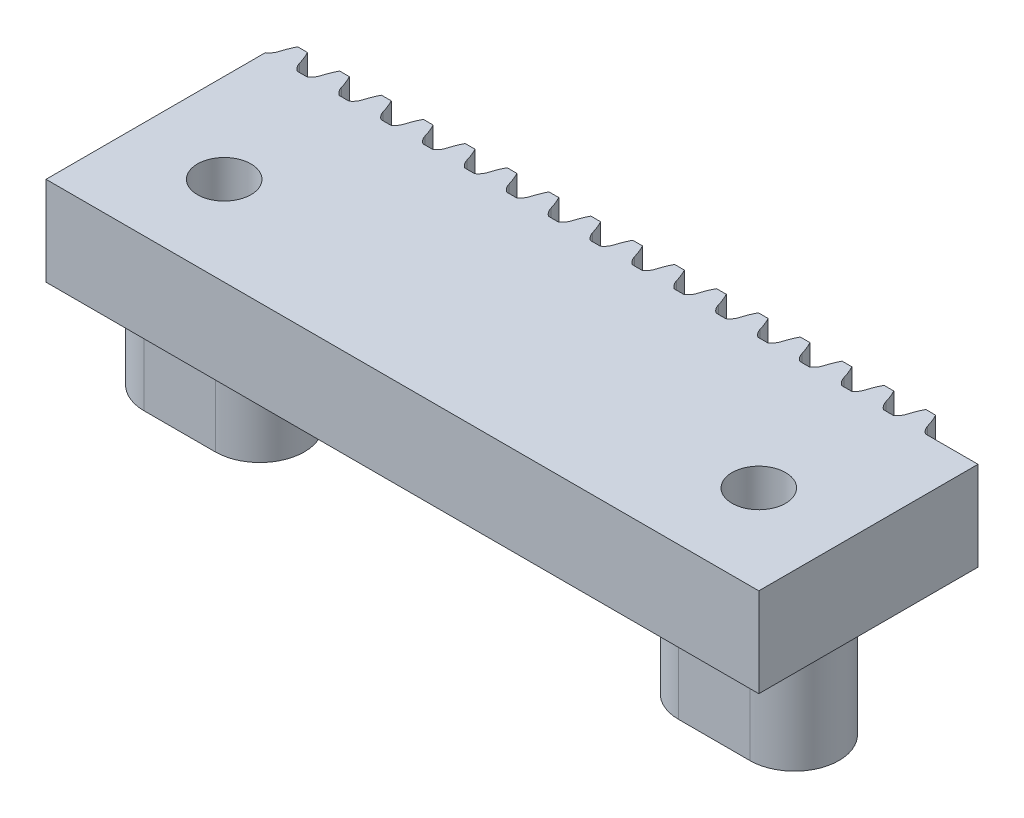
from build123d import *

# Parameters (mm, degrees)
BOSS_EXTRUDE1_DEPTH = 5
SKETCH2_R           = 1.5
BOSS_EXTRUDE2_DEPTH = 6
CUT_EXTRUDE1_REACH  = 44.641
SKETCH3_R           = 1.5


with BuildPart() as part:
    # Sketch1 → Boss-Extrude1 (new body)
    with BuildSketch(Plane(origin=(0, 0, 0), x_dir=(1, 0, 0), z_dir=(0, 1, 0))):
        with BuildLine():
            Line((0, 0), (40, 0))
            Line((40, 0), (40, 12.3))
            Line((40, 12.3), (37.05, 12.3))
            ThreePointArc((37.05, 12.3), (36.84816772, 12.496593354), (36.725, 12.75))
            ThreePointArc((36.725, 12.75), (36.593980723, 13.132592289), (36.425, 13.5))
            Line((36.425, 13.5), (35.875, 13.5))
            ThreePointArc((35.875, 13.5), (35.706019277, 13.132592289), (35.575, 12.75))
            ThreePointArc((35.575, 12.75), (35.45183228, 12.496593354), (35.25, 12.3))
            Line((35.25, 12.3), (34.7, 12.3))
            ThreePointArc((34.7, 12.3), (34.49816772, 12.496593354), (34.375, 12.75))
            ThreePointArc((34.375, 12.75), (34.243980723, 13.132592289), (34.075, 13.5))
            Line((34.075, 13.5), (33.525, 13.5))
            ThreePointArc((33.525, 13.5), (33.356019277, 13.132592289), (33.225, 12.75))
            ThreePointArc((33.225, 12.75), (33.10183228, 12.496593354), (32.9, 12.3))
            Line((32.9, 12.3), (32.35, 12.3))
            ThreePointArc((32.35, 12.3), (32.14816772, 12.496593354), (32.025, 12.75))
            ThreePointArc((32.025, 12.75), (31.893980723, 13.132592289), (31.725, 13.5))
            Line((31.725, 13.5), (31.175, 13.5))
            ThreePointArc((31.175, 13.5), (31.006019277, 13.132592289), (30.875, 12.75))
            ThreePointArc((30.875, 12.75), (30.75183228, 12.496593354), (30.55, 12.3))
            Line((30.55, 12.3), (30, 12.3))
            ThreePointArc((30, 12.3), (29.79816772, 12.496593354), (29.675, 12.75))
            ThreePointArc((29.675, 12.75), (29.543980723, 13.132592289), (29.375, 13.5))
            Line((29.375, 13.5), (28.825, 13.5))
            ThreePointArc((28.825, 13.5), (28.656019277, 13.132592289), (28.525, 12.75))
            ThreePointArc((28.525, 12.75), (28.40183228, 12.496593354), (28.2, 12.3))
            Line((28.2, 12.3), (27.65, 12.3))
            ThreePointArc((27.65, 12.3), (27.44816772, 12.496593354), (27.325, 12.75))
            ThreePointArc((27.325, 12.75), (27.193980723, 13.132592289), (27.025, 13.5))
            Line((27.025, 13.5), (26.475, 13.5))
            ThreePointArc((26.475, 13.5), (26.306019277, 13.132592289), (26.175, 12.75))
            ThreePointArc((26.175, 12.75), (26.05183228, 12.496593354), (25.85, 12.3))
            Line((25.85, 12.3), (25.3, 12.3))
            ThreePointArc((25.3, 12.3), (25.09816772, 12.496593354), (24.975, 12.75))
            ThreePointArc((24.975, 12.75), (24.843980723, 13.132592289), (24.675, 13.5))
            Line((24.675, 13.5), (24.125, 13.5))
            ThreePointArc((24.125, 13.5), (23.956019277, 13.132592289), (23.825, 12.75))
            ThreePointArc((23.825, 12.75), (23.70183228, 12.496593354), (23.5, 12.3))
            Line((23.5, 12.3), (22.95, 12.3))
            ThreePointArc((22.95, 12.3), (22.74816772, 12.496593354), (22.625, 12.75))
            ThreePointArc((22.625, 12.75), (22.493980723, 13.132592289), (22.325, 13.5))
            Line((22.325, 13.5), (21.775, 13.5))
            ThreePointArc((21.775, 13.5), (21.606019277, 13.132592289), (21.475, 12.75))
            ThreePointArc((21.475, 12.75), (21.35183228, 12.496593354), (21.15, 12.3))
            Line((21.15, 12.3), (20.6, 12.3))
            ThreePointArc((20.6, 12.3), (20.39816772, 12.496593354), (20.275, 12.75))
            ThreePointArc((20.275, 12.75), (20.143980723, 13.132592289), (19.975, 13.5))
            Line((19.975, 13.5), (19.425, 13.5))
            ThreePointArc((19.425, 13.5), (19.256019277, 13.132592289), (19.125, 12.75))
            ThreePointArc((19.125, 12.75), (19.00183228, 12.496593354), (18.8, 12.3))
            Line((18.8, 12.3), (18.25, 12.3))
            ThreePointArc((18.25, 12.3), (18.04816772, 12.496593354), (17.925, 12.75))
            ThreePointArc((17.925, 12.75), (17.793980723, 13.132592289), (17.625, 13.5))
            Line((17.625, 13.5), (17.075, 13.5))
            ThreePointArc((17.075, 13.5), (16.906019277, 13.132592289), (16.775, 12.75))
            ThreePointArc((16.775, 12.75), (16.65183228, 12.496593354), (16.45, 12.3))
            Line((16.45, 12.3), (15.9, 12.3))
            ThreePointArc((15.9, 12.3), (15.69816772, 12.496593354), (15.575, 12.75))
            ThreePointArc((15.575, 12.75), (15.443980723, 13.132592289), (15.275, 13.5))
            Line((15.275, 13.5), (14.725, 13.5))
            ThreePointArc((14.725, 13.5), (14.556019277, 13.132592289), (14.425, 12.75))
            ThreePointArc((14.425, 12.75), (14.30183228, 12.496593354), (14.1, 12.3))
            Line((14.1, 12.3), (13.55, 12.3))
            ThreePointArc((13.55, 12.3), (13.34816772, 12.496593354), (13.225, 12.75))
            ThreePointArc((13.225, 12.75), (13.093980723, 13.132592289), (12.925, 13.5))
            Line((12.925, 13.5), (12.375, 13.5))
            ThreePointArc((12.375, 13.5), (12.206019277, 13.132592289), (12.075, 12.75))
            ThreePointArc((12.075, 12.75), (11.95183228, 12.496593354), (11.75, 12.3))
            Line((11.75, 12.3), (11.2, 12.3))
            ThreePointArc((11.2, 12.3), (10.99816772, 12.496593354), (10.875, 12.75))
            ThreePointArc((10.875, 12.75), (10.743980723, 13.132592289), (10.575, 13.5))
            Line((10.575, 13.5), (10.025, 13.5))
            ThreePointArc((10.025, 13.5), (9.856019277, 13.132592289), (9.725, 12.75))
            ThreePointArc((9.725, 12.75), (9.60183228, 12.496593354), (9.4, 12.3))
            Line((9.4, 12.3), (8.85, 12.3))
            ThreePointArc((8.85, 12.3), (8.64816772, 12.496593354), (8.525, 12.75))
            ThreePointArc((8.525, 12.75), (8.393980723, 13.132592289), (8.225, 13.5))
            Line((8.225, 13.5), (7.675, 13.5))
            ThreePointArc((7.675, 13.5), (7.506019277, 13.132592289), (7.375, 12.75))
            ThreePointArc((7.375, 12.75), (7.25183228, 12.496593354), (7.05, 12.3))
            Line((7.05, 12.3), (6.5, 12.3))
            ThreePointArc((6.5, 12.3), (6.29816772, 12.496593354), (6.175, 12.75))
            ThreePointArc((6.175, 12.75), (6.043980723, 13.132592289), (5.875, 13.5))
            Line((5.875, 13.5), (5.325, 13.5))
            ThreePointArc((5.325, 13.5), (5.156019277, 13.132592289), (5.025, 12.75))
            ThreePointArc((5.025, 12.75), (4.90183228, 12.496593354), (4.7, 12.3))
            Line((4.7, 12.3), (4.15, 12.3))
            ThreePointArc((4.15, 12.3), (3.94816772, 12.496593354), (3.825, 12.75))
            ThreePointArc((3.825, 12.75), (3.693980723, 13.132592289), (3.525, 13.5))
            Line((3.525, 13.5), (2.975, 13.5))
            ThreePointArc((2.975, 13.5), (2.806019277, 13.132592289), (2.675, 12.75))
            ThreePointArc((2.675, 12.75), (2.55183228, 12.496593354), (2.35, 12.3))
            Line((2.35, 12.3), (1.8, 12.3))
            ThreePointArc((1.8, 12.3), (1.59816772, 12.496593354), (1.475, 12.75))
            ThreePointArc((1.475, 12.75), (1.343980723, 13.132592289), (1.175, 13.5))
            Line((1.175, 13.5), (0.625, 13.5))
            ThreePointArc((0.625, 13.5), (0.456019277, 13.132592289), (0.325, 12.75))
            ThreePointArc((0.325, 12.75), (0.20183228, 12.496593354), (0, 12.3))
            Line((0, 12.3), (0, 0))
        make_face()
    extrude(amount=BOSS_EXTRUDE1_DEPTH)

    # Sketch2 → Boss-Extrude2 (add)
    # profile 1 of 2: a face of its own
    with BuildSketch(Plane.XZ):
        with BuildLine():
            Line((7, -7.5), (3, -7.5))
            ThreePointArc((3, -7.5), (0.5, -5), (3, -2.5))
            Line((3, -2.5), (7, -2.5))
            ThreePointArc((7, -2.5), (9.5, -5), (7, -7.5))
        make_face()
        with Locations(Location((5, -5, 0), (0, 0, 270))):
            Circle(SKETCH2_R, mode=Mode.SUBTRACT)
    # profile 2 of 2: a face of its own
    with BuildSketch(Plane.XZ):
        with BuildLine():
            Line((37, -7.5), (33, -7.5))
            ThreePointArc((33, -7.5), (30.5, -5), (33, -2.5))
            Line((33, -2.5), (37, -2.5))
            ThreePointArc((37, -2.5), (39.5, -5), (37, -7.5))
        make_face()
        with Locations(Location((35, -5, 0), (0, 0, 270))):
            Circle(SKETCH2_R, mode=Mode.SUBTRACT)
    extrude(amount=BOSS_EXTRUDE2_DEPTH)

    # Sketch3 → Cut-Extrude1 (cut, up to next)
    with BuildSketch(Plane.XZ, mode=Mode.PRIVATE) as cut_extrude1_sk1:
        with Locations(Location((35, -5, 0), (0, 0, 270))):
            Circle(SKETCH3_R)
    cut_extrude1_tool1 = extrude(cut_extrude1_sk1.sketch, amount=-CUT_EXTRUDE1_REACH, mode=Mode.PRIVATE) & part.part
    # Sketch3 → Cut-Extrude1 (cut, up to next)
    with BuildSketch(Plane.XZ, mode=Mode.PRIVATE) as cut_extrude1_sk2:
        with Locations(Location((5, -5, 0), (0, 0, 270))):
            Circle(SKETCH3_R)
    cut_extrude1_tool2 = extrude(cut_extrude1_sk2.sketch, amount=-CUT_EXTRUDE1_REACH, mode=Mode.PRIVATE) & part.part
    add(cut_extrude1_tool1.solids().sort_by_distance((35, 0, -5))[0], mode=Mode.SUBTRACT)
    add(cut_extrude1_tool2.solids().sort_by_distance((5, 0, -5))[0], mode=Mode.SUBTRACT)


solid = part.part
